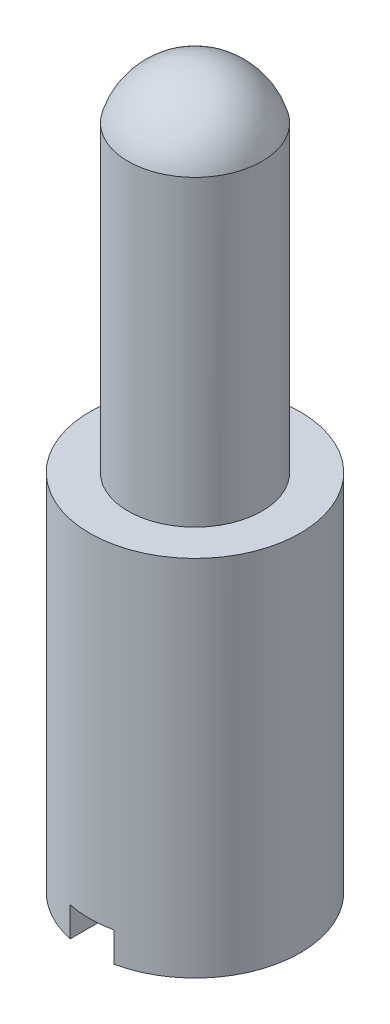
from build123d import *

# Parameters (mm, degrees)
CUT_EXTRUDE1_DEPTH      = 20.455471518
CUT_EXTRUDE1_DEPTH_BACK = 20.455471518
SKETCH2_W               = 1.1684
SKETCH2_H               = 0.7874


with BuildPart() as part:
    # Sketch1 → Revolve1 (revolve)
    with BuildSketch(Plane.XY, mode=Mode.PRIVATE) as revolve1_sk:
        with BuildLine():
            Line((0, 0), (0, 19.05))
            ThreePointArc((0, 19.05), (1.117279291, 18.67312328), (1.778, 17.696497855))
            Line((1.778, 17.696497855), (1.778, 9.652))
            Line((1.778, 9.652), (2.794, 9.652))
            Line((2.794, 9.652), (2.794, 0))
            Line((2.794, 0), (0, 0))
        make_face()
    revolve(revolve1_sk.sketch.rotate(Axis((0, 0, 0), (0, 1, 0)), 90), axis=Axis((0, 0, 0), (0, 1, 0)))

    # Sketch2 → Cut-Extrude1 (cut, two sides: drawn at the far end of the back side and taken through both)
    with BuildSketch(Plane.XY.offset(-CUT_EXTRUDE1_DEPTH_BACK)):
        with Locations((0, 0.3937)):
            Rectangle(SKETCH2_W, SKETCH2_H)
    extrude(amount=CUT_EXTRUDE1_DEPTH + CUT_EXTRUDE1_DEPTH_BACK, mode=Mode.SUBTRACT)


solid = part.part
